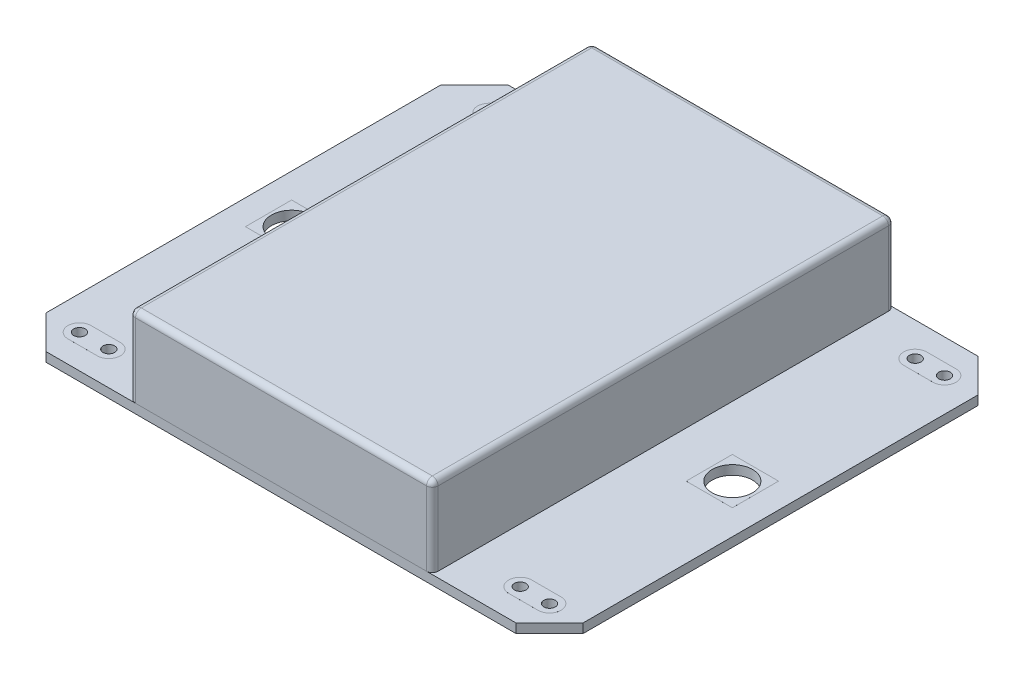
from build123d import *

# Parameters (mm, degrees)
BOSS_EXTRUDE1_DEPTH = 0.8
SKETCH2_W           = 26.2
SKETCH2_H           = 40
BOSS_EXTRUDE2_DEPTH = 6.9
FILLET1_R           = 0.5
BOSS_EXTRUDE3_DEPTH = 0.001
SKETCH4_R           = 0.5
CUT_EXTRUDE1_DEPTH  = 80.001
SKETCH5_W           = 4
SKETCH5_H           = 4
BOSS_EXTRUDE4_DEPTH = 0.001
SKETCH6_R           = 1.75
CUT_EXTRUDE2_DEPTH  = 70.001


with BuildPart() as part:
    # Sketch1 → Boss-Extrude1 (new body)
    with BuildSketch(Plane(origin=(0, 0, 0), x_dir=(1, 0, 0), z_dir=(0, 1, 0))):
        Polygon((-23.25, 17.1), (-20.35, 20), (20.35, 20), (23.25, 17.1), (23.25, -17.1), (20.35, -20), (-20.35, -20), (-23.25, -17.1), align=None)
    extrude(amount=BOSS_EXTRUDE1_DEPTH)

    # Sketch3 → Boss-Extrude3 (add)
    with BuildSketch(Plane(origin=(0, 0.8, 0), x_dir=(1, 0, 0), z_dir=(0, 1, 0))):
        with BuildLine():
            Line((17.81, 18.1), (20.35, 18.1))
            ThreePointArc((20.35, 18.1), (21.35, 17.1), (20.35, 16.1))
            Line((20.35, 16.1), (17.81, 16.1))
            ThreePointArc((17.81, 16.1), (16.81, 17.1), (17.81, 18.1))
        make_face()
        with BuildLine():
            Line((17.81, -16.1), (20.35, -16.1))
            ThreePointArc((20.35, -16.1), (21.35, -17.1), (20.35, -18.1))
            Line((20.35, -18.1), (17.81, -18.1))
            ThreePointArc((17.81, -18.1), (16.81, -17.1), (17.81, -16.1))
        make_face()
        with BuildLine():
            Line((-19.08, 18.1), (-16.54, 18.1))
            ThreePointArc((-16.54, 18.1), (-15.54, 17.1), (-16.54, 16.1))
            Line((-16.54, 16.1), (-19.08, 16.1))
            ThreePointArc((-19.08, 16.1), (-20.08, 17.1), (-19.08, 18.1))
        make_face()
        with BuildLine():
            Line((-20.35, -16.1), (-17.81, -16.1))
            ThreePointArc((-17.81, -16.1), (-16.81, -17.1), (-17.81, -18.1))
            Line((-17.81, -18.1), (-20.35, -18.1))
            ThreePointArc((-20.35, -18.1), (-21.35, -17.1), (-20.35, -16.1))
        make_face()
    extrude(amount=BOSS_EXTRUDE3_DEPTH)

    # Sketch4 → Cut-Extrude1 (cut)
    with BuildSketch(Plane(origin=(0, 0.801, 0), x_dir=(1, 0, 0), z_dir=(0, 1, 0))):
        with Locations(Location((-16.54, 17.1, 0), (0, 0, 270))):
            Circle(SKETCH4_R)
        with Locations(Location((-19.08, 17.1, 0), (0, 0, 270))):
            Circle(SKETCH4_R)
        with Locations(Location((20.35, 17.1, 0), (0, 0, 270))):
            Circle(SKETCH4_R)
        with Locations(Location((17.81, 17.1, 0), (0, 0, 270))):
            Circle(SKETCH4_R)
        with Locations(Location((20.35, -17.1, 0), (0, 0, 270))):
            Circle(SKETCH4_R)
        with Locations(Location((17.81, -17.1, 0), (0, 0, 270))):
            Circle(SKETCH4_R)
        with Locations(Location((-17.81, -17.1, 0), (0, 0, 270))):
            Circle(SKETCH4_R)
        with Locations(Location((-20.35, -17.1, 0), (0, 0, 270))):
            Circle(SKETCH4_R)
    extrude(amount=-CUT_EXTRUDE1_DEPTH, mode=Mode.SUBTRACT)

    # Sketch5 → Boss-Extrude4 (add)
    with BuildSketch(Plane(origin=(0, 0.8, 0), x_dir=(1, 0, 0), z_dir=(0, 1, 0))):
        with Locations((-19.08, 0)):
            Rectangle(SKETCH5_W, SKETCH5_H)
        with Locations((19.08, 0)):
            Rectangle(SKETCH5_W, SKETCH5_H)
    extrude(amount=BOSS_EXTRUDE4_DEPTH)

    # Sketch6 → Cut-Extrude2 (cut)
    with BuildSketch(Plane(origin=(0, 0.801, 0), x_dir=(1, 0, 0), z_dir=(0, 1, 0))):
        with Locations(Location((-19.08, 0, 0), (0, 0, 270))):
            Circle(SKETCH6_R)
        with Locations(Location((19.08, 0, 0), (0, 0, 270))):
            Circle(SKETCH6_R)
    extrude(amount=-CUT_EXTRUDE2_DEPTH, mode=Mode.SUBTRACT)


with BuildPart() as body_2:
    # Sketch2 → Boss-Extrude2 (new body)
    with BuildSketch(Plane(origin=(0, 0.8, 0), x_dir=(1, 0, 0), z_dir=(0, 1, 0))):
        Rectangle(SKETCH2_W, SKETCH2_H)
    extrude(amount=BOSS_EXTRUDE2_DEPTH)

    # Fillet1
    fillet1_edges = [body_2.edges().sort_by_distance(p)[0] for p in [
        (13.1, 7.7, 0),
        (0, 7.7, -20),
        (-13.1, 7.7, 0),
        (0, 7.7, 20),
        (-13.1, 4.25, -20),
        (13.1, 4.25, -20),
        (13.1, 4.25, 20),
        (-13.1, 4.25, 20),
    ]]
    fillet(fillet1_edges, radius=FILLET1_R)


solid = Compound([part.part, body_2.part])
